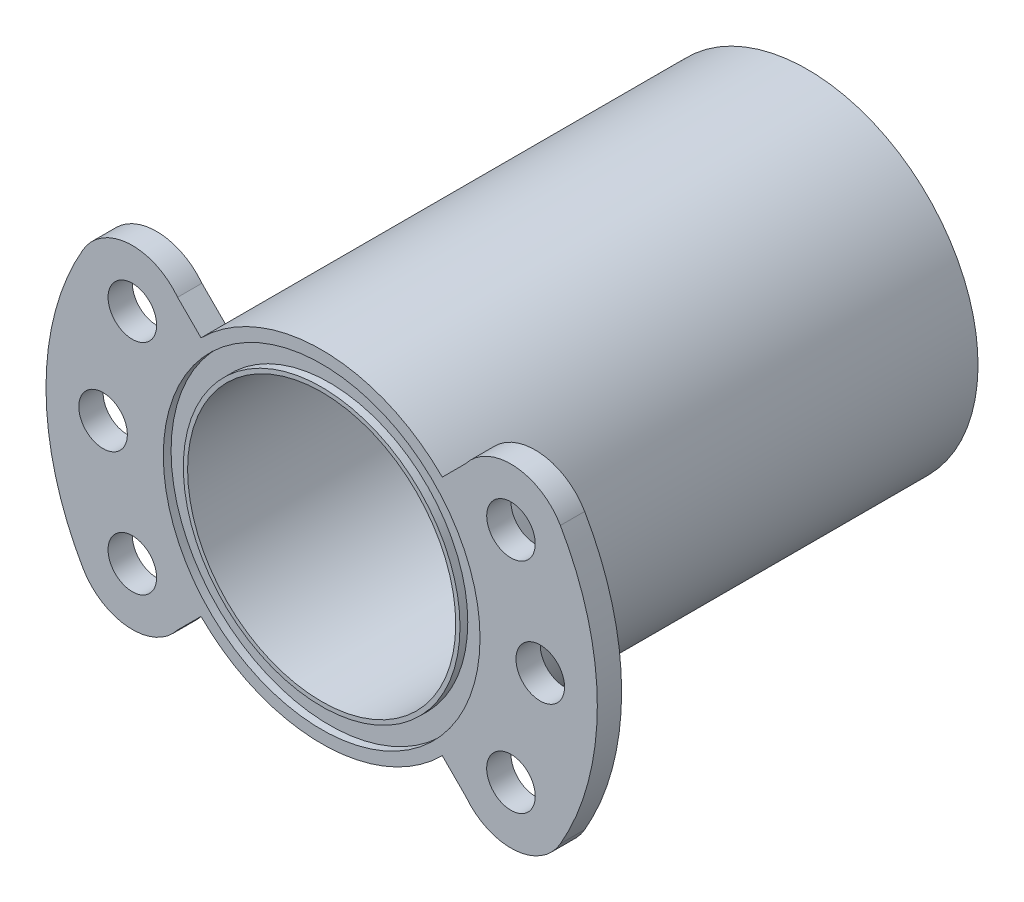
from build123d import *
from build123d.topology import SkipClean

# Parameters (mm, degrees)
SKETCH1_R           = 21.082
SKETCH1_R_2         = 17.526
BOSS_EXTRUDE1_DEPTH = 254
BOSS_EXTRUDE2_START = 6.35
SKETCH2_R           = 21.082
BOSS_EXTRUDE2_DEPTH = 6.35
SKETCH3_R           = 25.868376463
CUT_EXTRUDE1_DEPTH  = 127
SKETCH4_R           = 34.925
SKETCH4_R_2         = 19.091061219
BOSS_EXTRUDE3_DEPTH = 3.175
CUT_EXTRUDE2_DEPTH  = 143.203142546
CIRPATTERN1_COUNT   = 12
SKETCH6_R           = 21.082
CUT_EXTRUDE3_DEPTH  = 6.35
SKETCH7_R           = 21.082
BOSS_EXTRUDE4_DEPTH = 6.35
CUT_EXTRUDE5_DEPTH  = 137.26632471
BOSS_EXTRUDE5_DEPTH = 3.175
SKETCH13_R          = 20.701
SKETCH13_R_2        = 18.0848
CUT_EXTRUDE6_DEPTH  = 1.016
SKETCH14_R          = 22.3012
SKETCH14_R_2        = 20.701
BOSS_EXTRUDE6_DEPTH = 3.175
SKETCH15_R          = 3.175
SKETCH15_R_2        = 21.082
BOSS_EXTRUDE7_DEPTH = 123.825
SKETCH17_R          = 47.464750001
SKETCH17_R_2        = 22.3012
CUT_EXTRUDE7_DEPTH  = 120.65
SKETCH18_R          = 17.526
CUT_EXTRUDE8_DEPTH  = 134.883658048
CUT_EXTRUDE9_START  = -1.016
SKETCH19_R          = 20.701
SKETCH19_R_2        = 18.0848
CUT_EXTRUDE9_DEPTH  = 1.016
SKETCH20_R          = 43.35542212
CUT_EXTRUDE10_DEPTH = 25.4
SKETCH21_R          = 25.927665562
CUT_EXTRUDE11_DEPTH = 38.1
SKETCH22_R          = 20.063036937
BOSS_EXTRUDE8_DEPTH = 3.175


with BuildPart() as part:
    # Sketch1 → Boss-Extrude1 (new body)
    with BuildSketch(Plane.XY):
        Circle(SKETCH1_R)
        Circle(SKETCH1_R_2, mode=Mode.SUBTRACT)
    extrude(amount=BOSS_EXTRUDE1_DEPTH)

    # Sketch2 → Boss-Extrude2 (add)
    with BuildSketch(Plane(origin=(0, 0, 0), x_dir=(-1, 0, 0), z_dir=(0, 0, -1)).offset(BOSS_EXTRUDE2_START)):
        Circle(SKETCH2_R)
    extrude(amount=-BOSS_EXTRUDE2_DEPTH)

    # Sketch3 → Cut-Extrude1 (cut)
    with BuildSketch(Plane.XY.offset(254)):
        Circle(SKETCH3_R)
    extrude(amount=-CUT_EXTRUDE1_DEPTH, mode=Mode.SUBTRACT)

    # Sketch4 → Boss-Extrude3 (add)
    with BuildSketch(Plane.XY.offset(127)):
        Circle(SKETCH4_R)
        Circle(SKETCH4_R_2, mode=Mode.SUBTRACT)
    extrude(amount=-BOSS_EXTRUDE3_DEPTH)

    # Sketch5 → Cut-Extrude2 (cut, through all)
    with BuildSketch(Plane.XY.offset(127)):
        with BuildLine():
            ThreePointArc((0, 31.75), (-3.175, 28.575), (0, 25.4))
            Line((0, 25.4), (0, 31.75))
        make_face()
        with BuildLine():
            Line((0, 31.75), (0, 25.4))
            ThreePointArc((0, 25.4), (2.24506403, 26.32993597), (3.175, 28.575))
            ThreePointArc((3.175, 28.575), (2.24506403, 30.82006403), (0, 31.75))
        make_face()
    cut_extrude2 = extrude(amount=-CUT_EXTRUDE2_DEPTH, mode=Mode.SUBTRACT)

    # CirPattern1: Cut-Extrude2 ×12 about axis
    cirpattern1_axis = Axis((0, 0, 0), (0, 0, 1))
    for i in range(1, CIRPATTERN1_COUNT):
        add(cut_extrude2.rotate(cirpattern1_axis, i * 360 / CIRPATTERN1_COUNT), mode=Mode.SUBTRACT)

    # Sketch6 → Cut-Extrude3 (cut)
    with BuildSketch(Plane(origin=(0, 0, -6.35), x_dir=(-1, 0, 0), z_dir=(0, 0, -1))):
        Circle(SKETCH6_R)
    extrude(amount=-CUT_EXTRUDE3_DEPTH, mode=Mode.SUBTRACT)

    # Sketch7 → Boss-Extrude4 (add)
    with BuildSketch(Plane(origin=(0, 0, 0), x_dir=(-1, 0, 0), z_dir=(0, 0, -1))):
        Circle(SKETCH7_R)
    extrude(amount=-BOSS_EXTRUDE4_DEPTH)

    # Sketch8 → Cut-Extrude5 (cut, through all)
    with BuildSketch(Plane.XY.offset(127)):
        with BuildLine():
            ThreePointArc((18.828599641, 18.828599641), (22.949516837, 21.527350272), (27.854121372, 21.069018667))
            ThreePointArc((27.854121372, 21.069018667), (0, 34.925), (-27.854121372, 21.069018667))
            ThreePointArc((-27.854121372, 21.069018667), (-22.949516837, 21.527350272), (-18.828599641, 18.828599641))
            Line((-18.828599641, 18.828599641), (-14.907225161, 14.907225161))
            ThreePointArc((-14.907225161, 14.907225161), (0, 21.082), (14.907225161, 14.907225161))
            Line((14.907225161, 14.907225161), (18.828599641, 18.828599641))
        make_face()
        with BuildLine():
            ThreePointArc((14.907225161, -14.907225161), (0, -21.082), (-14.907225161, -14.907225161))
            Line((-14.907225161, -14.907225161), (-18.828599641, -18.828599641))
            ThreePointArc((-18.828599641, -18.828599641), (-22.949516837, -21.527350272), (-27.854121372, -21.069018667))
            ThreePointArc((-27.854121372, -21.069018667), (0, -34.925), (27.854121372, -21.069018667))
            ThreePointArc((27.854121372, -21.069018667), (22.949516837, -21.527350272), (18.828599641, -18.828599641))
            Line((18.828599641, -18.828599641), (14.907225161, -14.907225161))
        make_face()
    extrude(amount=-CUT_EXTRUDE5_DEPTH, mode=Mode.SUBTRACT)

    # Sketch11 → Boss-Extrude5 (add)
    with BuildSketch(Plane.XY.offset(127)):
        with BuildLine():
            ThreePointArc((31.206854634, 18.017286001), (29.767943301, 19.804028486), (27.854121372, 21.069018667))
            ThreePointArc((27.854121372, 21.069018667), (34.925, 0), (27.854121372, -21.069018667))
            ThreePointArc((27.854121372, -21.069018667), (29.767943301, -19.804028486), (31.206854634, -18.017286001))
            ThreePointArc((31.206854634, -18.017286001), (36.034571885, 0), (31.206854634, 18.017286001))
        make_face()
        with BuildLine():
            ThreePointArc((-27.854121372, 21.069018667), (-29.767943301, 19.804028486), (-31.206854634, 18.017286001))
            ThreePointArc((-31.206854634, 18.017286001), (-36.034571885, -1.77e-07), (-31.206854456, -18.017286308))
            ThreePointArc((-31.206854456, -18.017286308), (-29.767943169, -19.804028605), (-27.854121372, -21.069018667))
            ThreePointArc((-27.854121372, -21.069018667), (-34.925, 0), (-27.854121372, 21.069018667))
        make_face()
    extrude(amount=-BOSS_EXTRUDE5_DEPTH)

    # Sketch13 → Cut-Extrude6 (cut)
    with BuildSketch(Plane.XY.offset(127)):
        Circle(SKETCH13_R)
        Circle(SKETCH13_R_2, mode=Mode.SUBTRACT)
    extrude(amount=-CUT_EXTRUDE6_DEPTH, mode=Mode.SUBTRACT)

    # Sketch14 → Boss-Extrude6 (add)
    with BuildSketch(Plane.XY.offset(127)):
        Circle(SKETCH14_R)
        Circle(SKETCH14_R_2, mode=Mode.SUBTRACT)
    extrude(amount=-BOSS_EXTRUDE6_DEPTH)

    # Sketch15 → Boss-Extrude7 (add)
    with BuildSketch(Plane(origin=(0, 0, 123.825), x_dir=(-1, 0, 0), z_dir=(0, 0, -1))):
        with BuildLine():
            ThreePointArc((31.206854667, 18.017285943), (25.234555257, 21.731100369), (18.828599641, 18.828599641))
            Line((18.828599641, 18.828599641), (15.769329749, 15.769329749))
            ThreePointArc((15.769329749, 15.769329749), (0, 22.3012), (-15.769329749, 15.769329749))
            Line((-15.769329749, 15.769329749), (-18.828599641, 18.828599641))
            ThreePointArc((-18.828599641, 18.828599641), (-25.234555257, 21.731100369), (-31.206854667, 18.017285943))
            ThreePointArc((-31.206854667, 18.017285943), (-36.034571885, 0), (-31.206854667, -18.017285943))
            ThreePointArc((-31.206854667, -18.017285943), (-25.234555257, -21.731100369), (-18.828599641, -18.828599641))
            Line((-18.828599641, -18.828599641), (-15.769329749, -15.769329749))
            ThreePointArc((-15.769329749, -15.769329749), (0, -22.3012), (15.769329749, -15.769329749))
            Line((15.769329749, -15.769329749), (18.828599641, -18.828599641))
            ThreePointArc((18.828599641, -18.828599641), (25.234555257, -21.731100369), (31.206854667, -18.017285943))
            ThreePointArc((31.206854667, -18.017285943), (36.034571885, 0), (31.206854667, 18.017285943))
        make_face()
        with Locations(Location((28.575, 0, 0), (0, 0, 90))):
            Circle(SKETCH15_R, mode=Mode.SUBTRACT)
        with Locations(Location((-24.746675913, -14.2875, 0), (0, 0, 300))):
            Circle(SKETCH15_R, mode=Mode.SUBTRACT)
        with Locations(Location((-24.746675913, 14.2875, 0), (0, 0, 240))):
            Circle(SKETCH15_R, mode=Mode.SUBTRACT)
        with Locations(Location((-28.575, 0, 0), (0, 0, 270))):
            Circle(SKETCH15_R, mode=Mode.SUBTRACT)
        Circle(SKETCH15_R_2, mode=Mode.SUBTRACT)
        with Locations(Location((24.746675913, -14.2875, 0), (0, 0, 60))):
            Circle(SKETCH15_R, mode=Mode.SUBTRACT)
        with Locations(Location((24.746675913, 14.2875, 0), (0, 0, 120))):
            Circle(SKETCH15_R, mode=Mode.SUBTRACT)
    extrude(amount=BOSS_EXTRUDE7_DEPTH)

    # Sketch17 → Cut-Extrude7 (cut)
    with BuildSketch(Plane.XY.offset(123.825)):
        Circle(SKETCH17_R)
        with Locations(Location((0, 0, 0), (0, 0, 315))):
            Circle(SKETCH17_R_2, mode=Mode.SUBTRACT)
    extrude(amount=-CUT_EXTRUDE7_DEPTH, mode=Mode.SUBTRACT)

    # Sketch18 → Cut-Extrude8 (cut, through all)
    with BuildSketch(Plane.XY.offset(127)):
        Circle(SKETCH18_R)
    extrude(amount=-CUT_EXTRUDE8_DEPTH, mode=Mode.SUBTRACT)

    # Sketch19 → Cut-Extrude9 (cut)
    with BuildSketch(Plane(origin=(0, 0, 0), x_dir=(-1, 0, 0), z_dir=(0, 0, -1)).offset(CUT_EXTRUDE9_START)):
        with Locations(Location((0, 0, 0), (0, 0, 180))):
            Circle(SKETCH19_R)
        with Locations(Location((0, 0, 0), (0, 0, 180))):
            Circle(SKETCH19_R_2, mode=Mode.SUBTRACT)
    extrude(amount=CUT_EXTRUDE9_DEPTH, mode=Mode.SUBTRACT)

    # Sketch20 → Cut-Extrude10 (cut)
    with SkipClean():  # the faces are left unmerged after this step: merging them gives an invalid solid
        with BuildSketch(Plane(origin=(0, 0, 0), x_dir=(-1, 0, 0), z_dir=(0, 0, -1))):
            Circle(SKETCH20_R)
        extrude(amount=-CUT_EXTRUDE10_DEPTH, mode=Mode.SUBTRACT)

    # Sketch21 → Cut-Extrude11 (cut)
    with SkipClean():  # the faces are left unmerged after this step: merging them gives an invalid solid
        with BuildSketch(Plane(origin=(0, 0, 25.4), x_dir=(-1, 0, 0), z_dir=(0, 0, -1))):
            Circle(SKETCH21_R)
        extrude(amount=-CUT_EXTRUDE11_DEPTH, mode=Mode.SUBTRACT)

    # Sketch22 → Boss-Extrude8 (add)
    with SkipClean():  # the faces are left unmerged after this step: merging them gives an invalid solid
        with BuildSketch(Plane(origin=(0, 0, 63.5), x_dir=(-1, 0, 0), z_dir=(0, 0, -1))):
            Circle(SKETCH22_R)
        extrude(amount=-BOSS_EXTRUDE8_DEPTH)


solid = part.part
